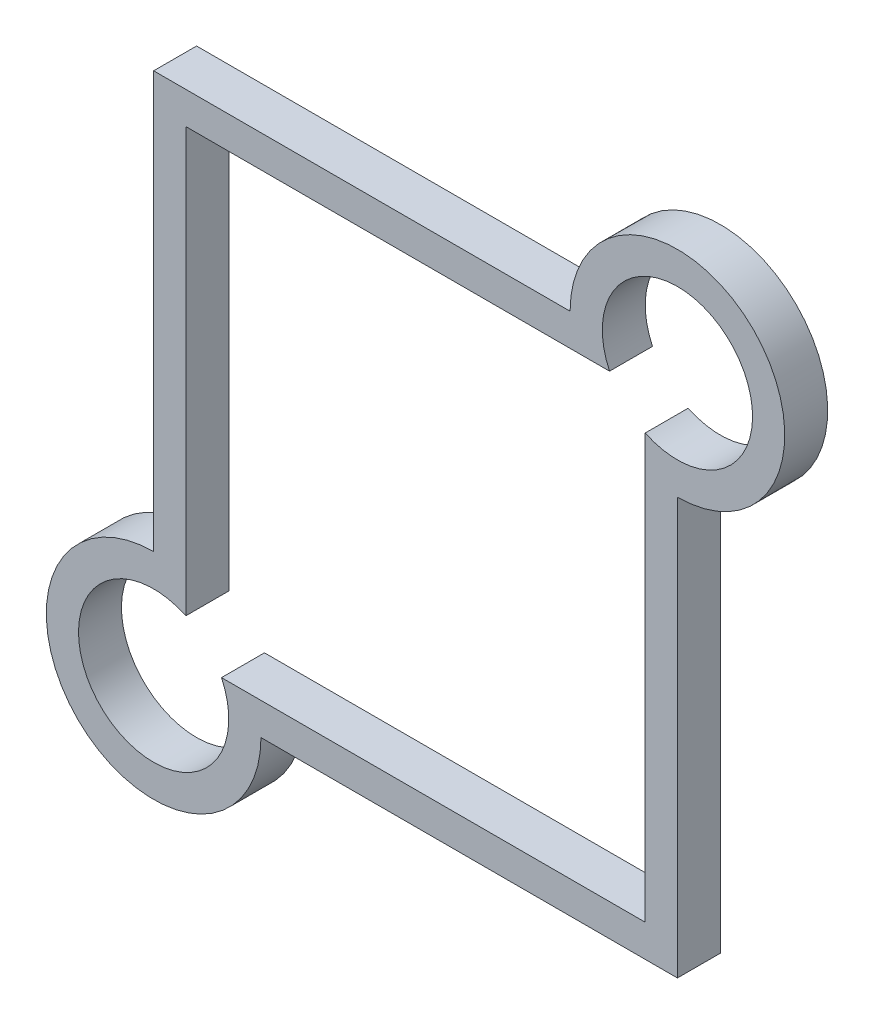
from build123d import *

# Parameters (mm, degrees)
BOSS_EXTRUDE1_DEPTH = 20


with BuildPart() as part:
    # Sketch1 → Boss-Extrude1 (new body)
    with BuildSketch(Plane.XY):
        with BuildLine():
            Line((-122, 122), (72, 122))
            ThreePointArc((72, 122), (157.355339059, 157.355339059), (122, 72))
            Line((122, 72), (122, -122))
            Line((122, -122), (-72, -122))
            ThreePointArc((-72, -122), (-157.355339059, -157.355339059), (-122, -72))
            Line((-122, -72), (-122, 122))
        make_face()
        with BuildLine():
            Line((-107, 107), (90.377223398, 107))
            ThreePointArc((90.377223398, 107), (146.748737342, 146.748737342), (107, 90.377223398))
            Line((107, 90.377223398), (107, -107))
            Line((107, -107), (-90.377223398, -107))
            ThreePointArc((-90.377223398, -107), (-146.748737342, -146.748737342), (-107, -90.377223398))
            Line((-107, -90.377223398), (-107, 107))
        make_face(mode=Mode.SUBTRACT)
    extrude(amount=BOSS_EXTRUDE1_DEPTH)


solid = part.part
